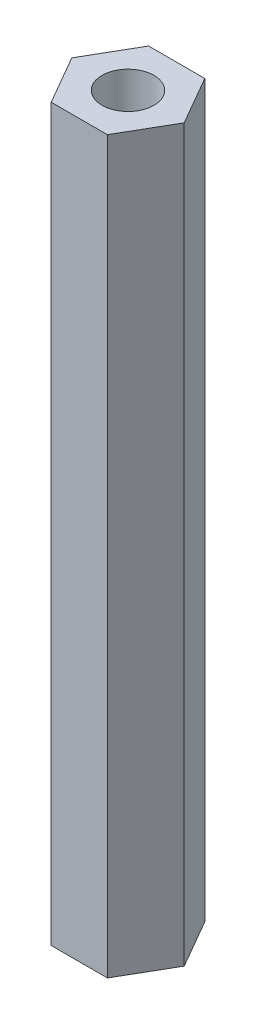
from build123d import *

# Parameters (mm, degrees)
SKETCH_1_R      = 1.6
EXTRUDE_1_DEPTH = 45


with BuildPart() as part:
    # 草图1 → 凸台-拉伸1 (new body)
    with BuildSketch(Plane(origin=(0, 0, 0), x_dir=(1, 0, 0), z_dir=(0, 1, 0))):
        Polygon((3.464101615, 0), (1.732050808, 3), (-1.732050808, 3), (-3.464101615, 0), (-1.732050808, -3), (1.732050808, -3), align=None)
        with Locations(Location((0, 0, 0), (0, 0, 90))):
            Circle(SKETCH_1_R, mode=Mode.SUBTRACT)
    extrude(amount=EXTRUDE_1_DEPTH)


solid = part.part
